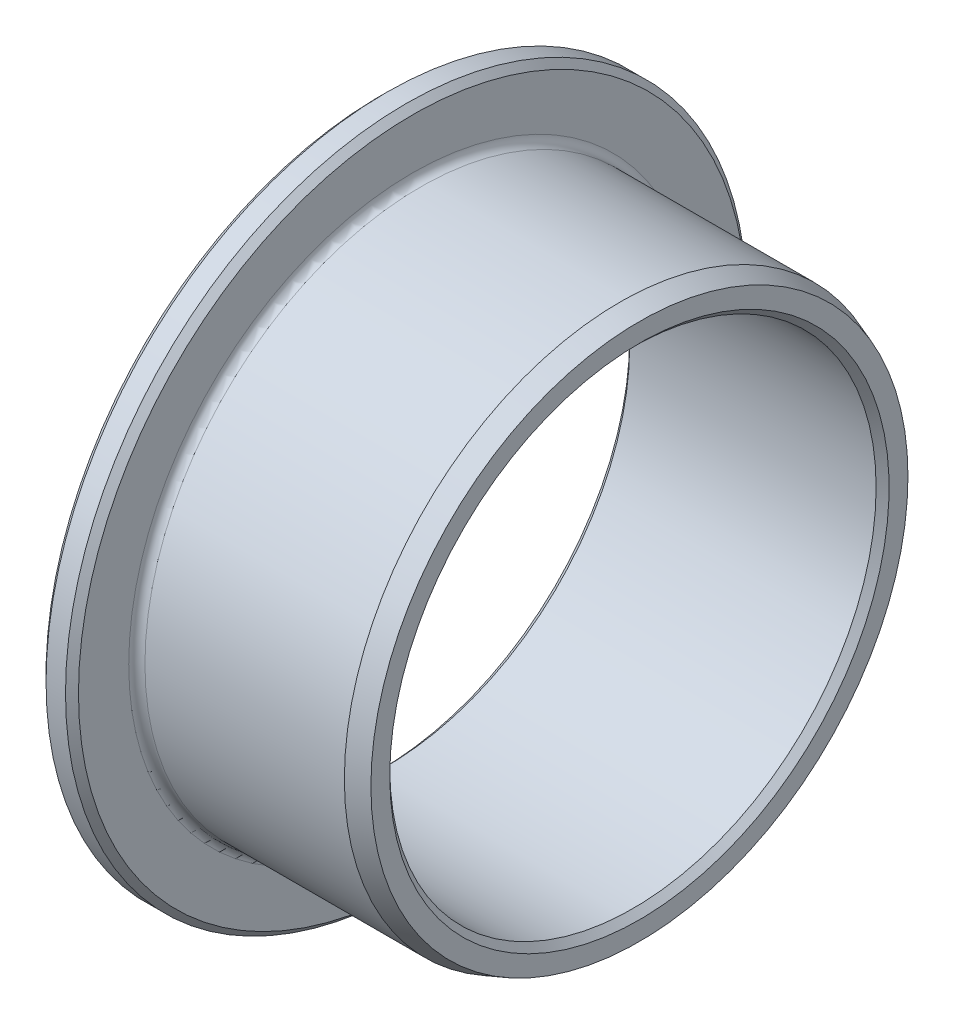
from build123d import *

# Parameters (mm, degrees)
CONG_2_R         = 0.5
CHANFREIN1_SIZE  = 0.4
CHANFREIN3_SIZE  = 1.2
CHANFREIN3_SIZE2 = 0.436764281


with BuildPart() as part:
    # Esquisse1 → Base-Révolution (revolve)
    with BuildSketch(Plane.XY, mode=Mode.PRIVATE) as base_r_volution_sk:
        Polygon((-2, 15), (-2, 21), (0, 21), (0, 17), (14, 17), (14, 15), align=None)
    revolve(base_r_volution_sk.sketch.rotate(Axis((-5.312682662, 0, 0), (1, 0, 0)), 90), axis=Axis((-5.312682662, 0, 0), (1, 0, 0)))

    # Congé2
    cong_2_edges = [part.edges().sort_by_distance(p)[0] for p in [
        (0, 0, -17),
    ]]
    fillet(cong_2_edges, radius=CONG_2_R)

    # Chanfrein1
    chanfrein1_edges = [part.edges().sort_by_distance(p)[0] for p in [
        (0, 0, -21),
        (-2, 0, -21),
        (-2, 0, -15),
        (14, 0, -15),
    ]]
    chamfer(chanfrein1_edges, length=CHANFREIN1_SIZE)

    # Chanfrein3
    chanfrein3_edges = [part.edges().sort_by_distance(p)[0] for p in [
        (14, 0, -17),
    ]]
    chanfrein3_side = [part.faces().sort_by_distance(p)[0] for p in [
        (7.25, 0, -17),
    ]]
    chamfer(chanfrein3_edges, length=CHANFREIN3_SIZE, length2=CHANFREIN3_SIZE2, reference=chanfrein3_side[0])


solid = part.part
